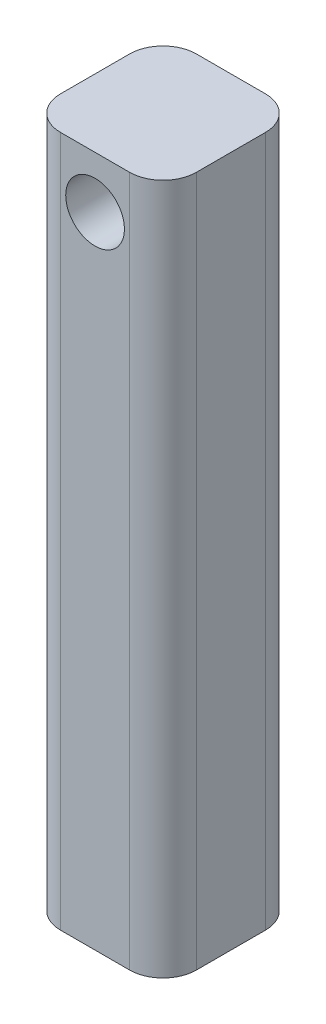
from build123d import *

# Parameters (mm, degrees)
SKETCH1_R           = 2.55
BOSS_EXTRUDE1_DEPTH = 52
BOSS_EXTRUDE2_DEPTH = 8
CUT_EXTRUDE1_DEPTH  = 1.525
SKETCH4_R           = 2.55
CUT_EXTRUDE2_DEPTH  = 62.43329716


with BuildPart() as part:
    # Sketch1 → Boss-Extrude1 (new body)
    with BuildSketch(Plane(origin=(0, 0, 0), x_dir=(1, 0, 0), z_dir=(0, 1, 0))):
        with BuildLine():
            Line((-3, -5.9), (3, -5.9))
            ThreePointArc((3, -5.9), (5.050609665, -5.050609665), (5.9, -3))
            Line((5.9, -3), (5.9, 3))
            ThreePointArc((5.9, 3), (5.050609665, 5.050609665), (3, 5.9))
            Line((3, 5.9), (-3, 5.9))
            ThreePointArc((-3, 5.9), (-5.050609665, 5.050609665), (-5.9, 3))
            Line((-5.9, 3), (-5.9, -3))
            ThreePointArc((-5.9, -3), (-5.050609665, -5.050609665), (-3, -5.9))
        make_face()
        with Locations(Location((0, 0, 0), (0, 0, 90))):
            Circle(SKETCH1_R, mode=Mode.SUBTRACT)
    extrude(amount=BOSS_EXTRUDE1_DEPTH)

    # Sketch2 → Boss-Extrude2 (add)
    with BuildSketch(Plane(origin=(0, 52, 0), x_dir=(1, 0, 0), z_dir=(0, 1, 0))):
        with BuildLine():
            Line((5.9, -3), (5.9, 3))
            ThreePointArc((5.9, 3), (5.050609665, 5.050609665), (3, 5.9))
            Line((3, 5.9), (-3, 5.9))
            ThreePointArc((-3, 5.9), (-5.050609665, 5.050609665), (-5.9, 3))
            Line((-5.9, 3), (-5.9, -3))
            ThreePointArc((-5.9, -3), (-5.050609665, -5.050609665), (-3, -5.9))
            Line((-3, -5.9), (3, -5.9))
            ThreePointArc((3, -5.9), (5.050609665, -5.050609665), (5.9, -3))
        make_face()
    extrude(amount=BOSS_EXTRUDE2_DEPTH)

    # Sketch3 → Cut-Extrude1 (cut, symmetric)
    with BuildSketch(Plane(origin=(0, 3, 0), x_dir=(-1, 0, 0), z_dir=(0, -1, 0))):
        Polygon((2.742413779, 4.75), (6.305323331, 4.75), (6.305323331, -4.75), (2.742413779, -4.75), (-2.742413779, -4.75), (-5.484827557, 0), (-2.742413779, 4.75), align=None)
    extrude(amount=CUT_EXTRUDE1_DEPTH, both=True, mode=Mode.SUBTRACT)

    # Sketch4 → Cut-Extrude2 (cut, through all)
    with BuildSketch(Plane(origin=(0, 0, -5.9), x_dir=(-1, 0, 0), z_dir=(0, 0, -1))):
        with Locations((0, 55.5)):
            Circle(SKETCH4_R)
    extrude(amount=-CUT_EXTRUDE2_DEPTH, mode=Mode.SUBTRACT)


solid = part.part
